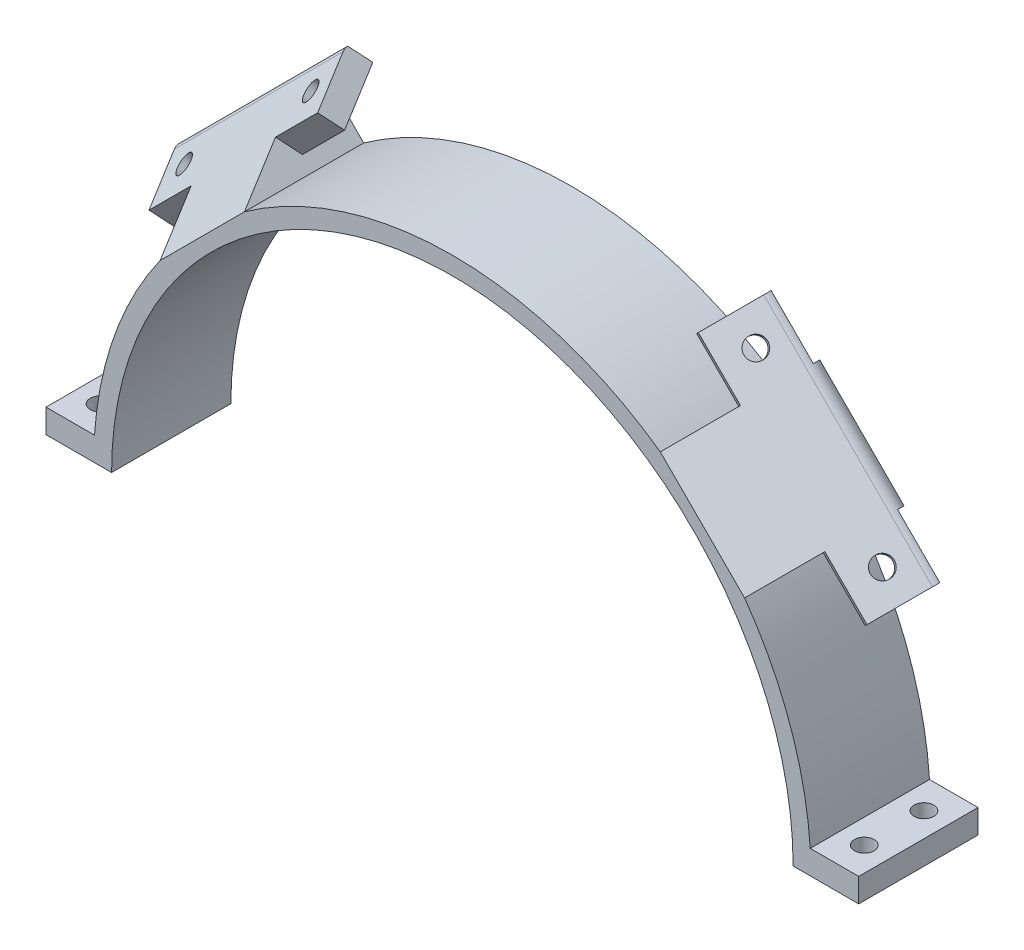
from build123d import *

# Parameters (mm, degrees)
EXTRUDE_1_DEPTH     = 20
EXTRUDE_2_DEPTH     = 20
CUT_EXTRUDE_1_REACH = 99.146
CUT_EXTRUDE_2_REACH = 99.146
EXTRUDE_3_DEPTH     = 4
EXTRUDE_4_DEPTH     = 4
CUT_EXTRUDE_3_REACH = 113.665
SKETCH_8_R          = 1.65
FILLET_1_R          = 2
CUT_EXTRUDE_4_REACH = 113.513
SKETCH_9_R          = 1.65
SKETCH_10_W         = 10
SKETCH_10_H         = 20
EXTRUDE_5_DEPTH     = 4
CUT_EXTRUDE_5_REACH = 94.836
SKETCH_11_R         = 1.65


with BuildPart() as part:
    # ｽｹｯﾁ1 → ﾎﾞｽ - 押し出し1 (new body)
    with BuildSketch(Plane.XY):
        with BuildLine():
            Line((-57.15, 0), (-60.15, 0))
            ThreePointArc((-60.15, 0), (0, 60.15), (60.15, 0))
            Line((60.15, 0), (57.15, 0))
            ThreePointArc((57.15, 0), (0, 57.15), (-57.15, 0))
        make_face()
    extrude(amount=EXTRUDE_1_DEPTH)

    # ｽｹｯﾁ3 → ﾎﾞｽ - 押し出し2 (add)
    with BuildSketch(Plane.XY.offset(20)):
        Polygon((-41.94056807, 41.94056807), (-34.869500258, 49.011635881), (-43.708335023, 57.850470646), (-57.850470646, 43.708335023), (-49.011635881, 34.869500258), align=None)
        Polygon((57.850470646, 43.708335023), (49.011635881, 34.869500258), (41.94056807, 41.94056807), (34.869500258, 49.011635881), (43.708335023, 57.850470646), align=None)
    extrude(amount=-EXTRUDE_2_DEPTH)

    # ｽｹｯﾁ4 → ｶｯﾄ - 押し出し1 (cut, up to next)
    with BuildSketch(Plane(origin=(-7.071067812, -7.071067812, 0), x_dir=(0, 0, 1), z_dir=(-0.7071067811865431, -0.7071067811865519, 0)), mode=Mode.PRIVATE) as cut_extrude_1_sk1:
        Polygon((0, 71.812920178), (20, 59.312920178), (20, 71.812920178), align=None)
    cut_extrude_1_tool1 = extrude(cut_extrude_1_sk1.sketch, amount=-CUT_EXTRUDE_1_REACH, mode=Mode.PRIVATE) & part.part
    add(cut_extrude_1_tool1.solids().sort_by_distance((-54.904192, 40.762057, 13.333333))[0], mode=Mode.SUBTRACT)

    # ｽｹｯﾁ5 → ｶｯﾄ - 押し出し2 (cut, up to next)
    with BuildSketch(Plane(origin=(7.071067812, -7.071067812, 0), x_dir=(0, 0, -1), z_dir=(0.7071067811865431, -0.7071067811865519, 0)), mode=Mode.PRIVATE) as cut_extrude_2_sk1:
        Polygon((0, 71.812920178), (-20, 59.312920178), (-20, 71.812920178), align=None)
    cut_extrude_2_tool1 = extrude(cut_extrude_2_sk1.sketch, amount=-CUT_EXTRUDE_2_REACH, mode=Mode.PRIVATE) & part.part
    add(cut_extrude_2_tool1.solids().sort_by_distance((54.904192, 40.762057, 13.333333))[0], mode=Mode.SUBTRACT)

    # ｽｹｯﾁ6 → ﾎﾞｽ - 押し出し3 (add)
    with BuildSketch(Plane(origin=(-36.515525634, 36.515525634, 32.275469743), x_dir=(0.7991544988642271, 0.4135236263174359, 0.4362915280203637), z_dir=(-0.5996253511966934, 0.5996253511966858, 0.5299989400031792))):
        Polygon((-26.82708742, 25.275306051), (-35.402016678, 20.130348497), (-30.257059123, 11.55541924), (-21.682129866, 16.700376794), align=None)
        Polygon((4.042657905, 32.135249457), (-4.532271352, 26.990291903), (-9.677228906, 35.56522116), (-1.102299649, 40.710178714), align=None)
    extrude(amount=-EXTRUDE_3_DEPTH)

    # ｽｹｯﾁ7 → ﾎﾞｽ - 押し出し4 (add)
    with BuildSketch(Plane(origin=(36.515525634, 36.515525634, 32.275469743), x_dir=(0.7991544988642272, -0.41352362631743567, -0.43629152802036364), z_dir=(0.5996253511966931, 0.5996253511966856, 0.5299989400031795))):
        Polygon((9.677228906, 35.56522116), (4.532271352, 26.990291903), (-4.042657905, 32.135249457), (1.102299649, 40.710178714), align=None)
        Polygon((30.257059123, 11.55541924), (35.402016678, 20.130348497), (26.82708742, 25.275306051), (21.682129866, 16.700376794), align=None)
    extrude(amount=-EXTRUDE_4_DEPTH)

    # ｽｹｯﾁ8 → ｶｯﾄ - 押し出し3 (cut, up to next)
    with BuildSketch(Plane(origin=(36.515525634, 36.515525634, 32.275469743), x_dir=(0.7991544988642272, -0.41352362631743567, -0.43629152802036364), z_dir=(0.5996253511966931, 0.5996253511966856, 0.5299989400031795)), mode=Mode.PRIVATE) as cut_extrude_3_sk1:
        with Locations(Location((2.817285501, 33.850235308, 0), (0, 0, 149.036243468))):
            Circle(SKETCH_8_R)
    cut_extrude_3_tool1 = extrude(cut_extrude_3_sk1.sketch, amount=-CUT_EXTRUDE_3_REACH, mode=Mode.PRIVATE) & part.part
    # ｽｹｯﾁ8 → ｶｯﾄ - 押し出し3 (cut, up to next)
    with BuildSketch(Plane(origin=(36.515525634, 36.515525634, 32.275469743), x_dir=(0.7991544988642272, -0.41352362631743567, -0.43629152802036364), z_dir=(0.5996253511966931, 0.5996253511966856, 0.5299989400031795)), mode=Mode.PRIVATE) as cut_extrude_3_sk2:
        with Locations(Location((28.542073272, 18.415362646, 0), (0, 0, 149.036243468))):
            Circle(SKETCH_8_R)
    cut_extrude_3_tool2 = extrude(cut_extrude_3_sk2.sketch, amount=-CUT_EXTRUDE_3_REACH, mode=Mode.PRIVATE) & part.part
    add(cut_extrude_3_tool1.solids().sort_by_distance((37.33022, 58.543423, 6.432027))[0], mode=Mode.SUBTRACT)
    add(cut_extrude_3_tool2.solids().sort_by_distance((58.543423, 37.33022, 6.432027))[0], mode=Mode.SUBTRACT)

    # ﾌｨﾚｯﾄ1
    fillet_1_edges = [part.edges().sort_by_distance(p)[0] for p in [
        (50.779402834, 50.779402834, 0),
        (-50.779402834, 50.779402834, 0),
    ]]
    fillet(fillet_1_edges, radius=FILLET_1_R)

    # ｽｹｯﾁ9 → ｶｯﾄ - 押し出し4 (cut, up to next)
    with BuildSketch(Plane(origin=(-36.515525634, 36.515525634, 32.275469743), x_dir=(0.7991544988642271, 0.4135236263174359, 0.4362915280203637), z_dir=(-0.5996253511966934, 0.5996253511966858, 0.5299989400031792)), mode=Mode.PRIVATE) as cut_extrude_4_sk1:
        with Locations(Location((-2.817285501, 33.850235308, 0), (0, 0, 210.963756532))):
            Circle(SKETCH_9_R)
    cut_extrude_4_tool1 = extrude(cut_extrude_4_sk1.sketch, amount=-CUT_EXTRUDE_4_REACH, mode=Mode.PRIVATE) & part.part
    # ｽｹｯﾁ9 → ｶｯﾄ - 押し出し4 (cut, up to next)
    with BuildSketch(Plane(origin=(-36.515525634, 36.515525634, 32.275469743), x_dir=(0.7991544988642271, 0.4135236263174359, 0.4362915280203637), z_dir=(-0.5996253511966934, 0.5996253511966858, 0.5299989400031792)), mode=Mode.PRIVATE) as cut_extrude_4_sk2:
        with Locations(Location((-28.542073272, 18.415362646, 0), (0, 0, 210.963756532))):
            Circle(SKETCH_9_R)
    cut_extrude_4_tool2 = extrude(cut_extrude_4_sk2.sketch, amount=-CUT_EXTRUDE_4_REACH, mode=Mode.PRIVATE) & part.part
    add(cut_extrude_4_tool1.solids().sort_by_distance((-37.33022, 58.543423, 6.432027))[0], mode=Mode.SUBTRACT)
    add(cut_extrude_4_tool2.solids().sort_by_distance((-58.543423, 37.33022, 6.432027))[0], mode=Mode.SUBTRACT)

    # ｽｹｯﾁ10 → ﾎﾞｽ - 押し出し5 (add)
    with BuildSketch(Plane.XZ):
        with Locations((-63.15, 10)):
            Rectangle(SKETCH_10_W, SKETCH_10_H)
        with Locations((63.15, 10)):
            Rectangle(SKETCH_10_W, SKETCH_10_H)
    extrude(amount=-EXTRUDE_5_DEPTH)

    # ｽｹｯﾁ11 → ｶｯﾄ - 押し出し5 (cut, up to next)
    with BuildSketch(Plane(origin=(0, 4, 0), x_dir=(1, 0, 0), z_dir=(0, 1, 0)), mode=Mode.PRIVATE) as cut_extrude_5_sk1:
        with Locations(Location((64.0834259, -5, 0), (0, 0, 180))):
            Circle(SKETCH_11_R)
    cut_extrude_5_tool1 = extrude(cut_extrude_5_sk1.sketch, amount=-CUT_EXTRUDE_5_REACH, mode=Mode.PRIVATE) & part.part
    # ｽｹｯﾁ11 → ｶｯﾄ - 押し出し5 (cut, up to next)
    with BuildSketch(Plane(origin=(0, 4, 0), x_dir=(1, 0, 0), z_dir=(0, 1, 0)), mode=Mode.PRIVATE) as cut_extrude_5_sk2:
        with Locations(Location((64.0834259, -15, 0), (0, 0, 180))):
            Circle(SKETCH_11_R)
    cut_extrude_5_tool2 = extrude(cut_extrude_5_sk2.sketch, amount=-CUT_EXTRUDE_5_REACH, mode=Mode.PRIVATE) & part.part
    # ｽｹｯﾁ11 → ｶｯﾄ - 押し出し5 (cut, up to next)
    with BuildSketch(Plane(origin=(0, 4, 0), x_dir=(1, 0, 0), z_dir=(0, 1, 0)), mode=Mode.PRIVATE) as cut_extrude_5_sk3:
        with Locations(Location((-64.0834259, -15, 0), (0, 0, 180))):
            Circle(SKETCH_11_R)
    cut_extrude_5_tool3 = extrude(cut_extrude_5_sk3.sketch, amount=-CUT_EXTRUDE_5_REACH, mode=Mode.PRIVATE) & part.part
    # ｽｹｯﾁ11 → ｶｯﾄ - 押し出し5 (cut, up to next)
    with BuildSketch(Plane(origin=(0, 4, 0), x_dir=(1, 0, 0), z_dir=(0, 1, 0)), mode=Mode.PRIVATE) as cut_extrude_5_sk4:
        with Locations(Location((-64.0834259, -5, 0), (0, 0, 180))):
            Circle(SKETCH_11_R)
    cut_extrude_5_tool4 = extrude(cut_extrude_5_sk4.sketch, amount=-CUT_EXTRUDE_5_REACH, mode=Mode.PRIVATE) & part.part
    add(cut_extrude_5_tool1.solids().sort_by_distance((64.083426, 4, 5))[0], mode=Mode.SUBTRACT)
    add(cut_extrude_5_tool2.solids().sort_by_distance((64.083426, 4, 15))[0], mode=Mode.SUBTRACT)
    add(cut_extrude_5_tool3.solids().sort_by_distance((-64.083426, 4, 15))[0], mode=Mode.SUBTRACT)
    add(cut_extrude_5_tool4.solids().sort_by_distance((-64.083426, 4, 5))[0], mode=Mode.SUBTRACT)


solid = part.part
